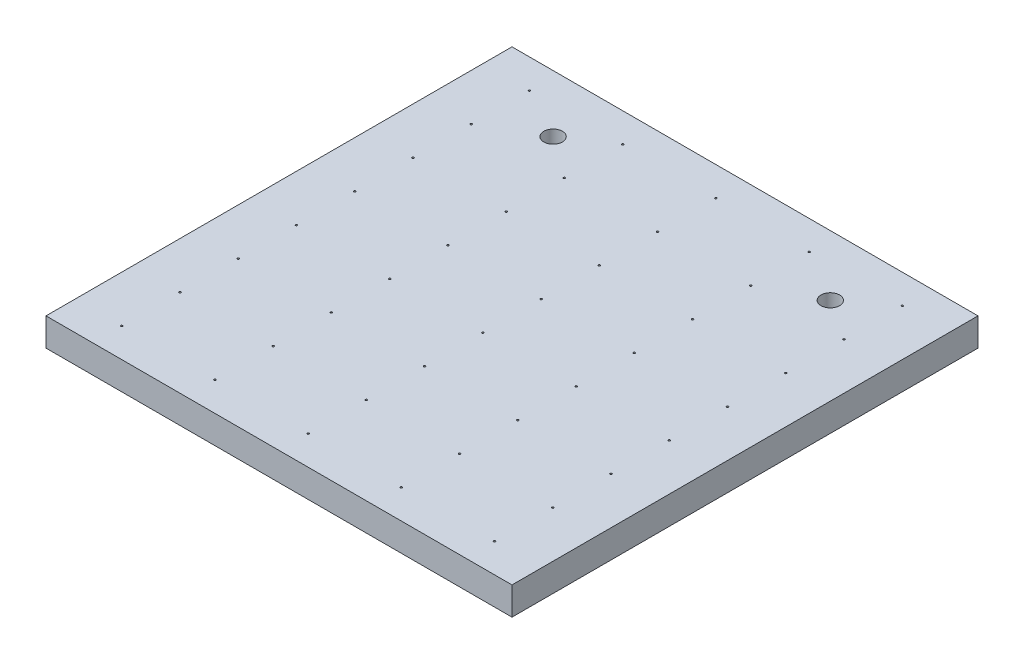
from build123d import *

# Parameters (mm, degrees)
SKETCH_1_W              = 50
SKETCH_1_H              = 50
EXTRUDE_1_DEPTH         = 3
SKETCH_2_R              = 0.1
CUT_EXTRUDE_5_DEPTH     = 0.6
PATTERN_LINEAR_6_COUNT  = 5
PATTERN_LINEAR_6_PITCH  = 10
SKETCH_6_R              = 0.1
CUT_EXTRUDE_6_DEPTH     = 0.8
PATTERN_LINEAR_7_COUNT  = 5
PATTERN_LINEAR_7_PITCH  = 10
SKETCH_7_R              = 0.1
CUT_EXTRUDE_7_DEPTH     = 1
PATTERN_LINEAR_8_COUNT  = 5
PATTERN_LINEAR_8_PITCH  = 10
SKETCH_8_R              = 0.1
CUT_EXTRUDE_8_DEPTH     = 1.2
PATTERN_LINEAR_9_COUNT  = 5
PATTERN_LINEAR_9_PITCH  = 10
SKETCH_9_R              = 0.1
CUT_EXTRUDE_9_DEPTH     = 1.4
PATTERN_LINEAR_10_COUNT = 5
PATTERN_LINEAR_10_PITCH = 10
SKETCH_10_R             = 0.1
CUT_EXTRUDE_10_DEPTH    = 1.6
PATTERN_LINEAR_11_COUNT = 5
PATTERN_LINEAR_11_PITCH = 10
SKETCH_11_R             = 0.1
CUT_EXTRUDE_11_DEPTH    = 1.8
PATTERN_LINEAR_12_COUNT = 5
PATTERN_LINEAR_12_PITCH = 10
SKETCH_12_R             = 0.1
CUT_EXTRUDE_12_DEPTH    = 2
PATTERN_LINEAR_13_COUNT = 5
PATTERN_LINEAR_13_PITCH = 10
SKETCH_13_R             = 1
CUT_EXTRUDE_13_DEPTH    = 36.482389998
SKETCH_14_R             = 1
CUT_EXTRUDE_14_DEPTH    = 36.482389998


with BuildPart() as part:
    # 草图1 → 凸台-拉伸1 (new body)
    with BuildSketch(Plane(origin=(0, 0, 0), x_dir=(1, 0, 0), z_dir=(0, 1, 0))):
        Rectangle(SKETCH_1_W, SKETCH_1_H)
    extrude(amount=EXTRUDE_1_DEPTH)

    # 草图2 → 切除-拉伸5 (cut)
    with BuildSketch(Plane(origin=(0, 3, 0), x_dir=(1, 0, 0), z_dir=(0, 1, 0))):
        with Locations(Location((-20, 21.875, 0), (0, 0, 270))):
            Circle(SKETCH_2_R)
    cut_extrude_5 = extrude(amount=-CUT_EXTRUDE_5_DEPTH, mode=Mode.SUBTRACT)

    # 阵列(线性)6: 切除-拉伸5 ×5
    with Locations(*[(i * PATTERN_LINEAR_6_PITCH, 0, 0) for i in range(1, PATTERN_LINEAR_6_COUNT)]):
        add(cut_extrude_5, mode=Mode.SUBTRACT)

    # 草图6 → 切除-拉伸6 (cut)
    with BuildSketch(Plane(origin=(0, 3, 0), x_dir=(1, 0, 0), z_dir=(0, 1, 0))):
        with Locations(Location((-20, 15.625, 0), (0, 0, 270))):
            Circle(SKETCH_6_R)
    cut_extrude_6 = extrude(amount=-CUT_EXTRUDE_6_DEPTH, mode=Mode.SUBTRACT)

    # 阵列(线性)7: 切除-拉伸6 ×5
    with Locations(*[(i * PATTERN_LINEAR_7_PITCH, 0, 0) for i in range(1, PATTERN_LINEAR_7_COUNT)]):
        add(cut_extrude_6, mode=Mode.SUBTRACT)

    # 草图7 → 切除-拉伸7 (cut)
    with BuildSketch(Plane(origin=(0, 3, 0), x_dir=(1, 0, 0), z_dir=(0, 1, 0))):
        with Locations(Location((-20, 9.375, 0), (0, 0, 270))):
            Circle(SKETCH_7_R)
    cut_extrude_7 = extrude(amount=-CUT_EXTRUDE_7_DEPTH, mode=Mode.SUBTRACT)

    # 阵列(线性)8: 切除-拉伸7 ×5
    with Locations(*[(i * PATTERN_LINEAR_8_PITCH, 0, 0) for i in range(1, PATTERN_LINEAR_8_COUNT)]):
        add(cut_extrude_7, mode=Mode.SUBTRACT)

    # 草图8 → 切除-拉伸8 (cut)
    with BuildSketch(Plane(origin=(0, 3, 0), x_dir=(1, 0, 0), z_dir=(0, 1, 0))):
        with Locations(Location((-20, 3.125, 0), (0, 0, 270))):
            Circle(SKETCH_8_R)
    cut_extrude_8 = extrude(amount=-CUT_EXTRUDE_8_DEPTH, mode=Mode.SUBTRACT)

    # 阵列(线性)9: 切除-拉伸8 ×5
    with Locations(*[(i * PATTERN_LINEAR_9_PITCH, 0, 0) for i in range(1, PATTERN_LINEAR_9_COUNT)]):
        add(cut_extrude_8, mode=Mode.SUBTRACT)

    # 草图9 → 切除-拉伸9 (cut)
    with BuildSketch(Plane(origin=(0, 3, 0), x_dir=(1, 0, 0), z_dir=(0, 1, 0))):
        with Locations(Location((-20, -3.125, 0), (0, 0, 270))):
            Circle(SKETCH_9_R)
    cut_extrude_9 = extrude(amount=-CUT_EXTRUDE_9_DEPTH, mode=Mode.SUBTRACT)

    # 阵列(线性)10: 切除-拉伸9 ×5
    with Locations(*[(i * PATTERN_LINEAR_10_PITCH, 0, 0) for i in range(1, PATTERN_LINEAR_10_COUNT)]):
        add(cut_extrude_9, mode=Mode.SUBTRACT)

    # 草图10 → 切除-拉伸10 (cut)
    with BuildSketch(Plane(origin=(0, 3, 0), x_dir=(1, 0, 0), z_dir=(0, 1, 0))):
        with Locations(Location((-20, -9.375, 0), (0, 0, 270))):
            Circle(SKETCH_10_R)
    cut_extrude_10 = extrude(amount=-CUT_EXTRUDE_10_DEPTH, mode=Mode.SUBTRACT)

    # 阵列(线性)11: 切除-拉伸10 ×5
    with Locations(*[(i * PATTERN_LINEAR_11_PITCH, 0, 0) for i in range(1, PATTERN_LINEAR_11_COUNT)]):
        add(cut_extrude_10, mode=Mode.SUBTRACT)

    # 草图11 → 切除-拉伸11 (cut)
    with BuildSketch(Plane(origin=(0, 3, 0), x_dir=(1, 0, 0), z_dir=(0, 1, 0))):
        with Locations(Location((-20, -15.625, 0), (0, 0, 270))):
            Circle(SKETCH_11_R)
    cut_extrude_11 = extrude(amount=-CUT_EXTRUDE_11_DEPTH, mode=Mode.SUBTRACT)

    # 阵列(线性)12: 切除-拉伸11 ×5
    with Locations(*[(i * PATTERN_LINEAR_12_PITCH, 0, 0) for i in range(1, PATTERN_LINEAR_12_COUNT)]):
        add(cut_extrude_11, mode=Mode.SUBTRACT)

    # 草图12 → 切除-拉伸12 (cut)
    with BuildSketch(Plane(origin=(0, 3, 0), x_dir=(1, 0, 0), z_dir=(0, 1, 0))):
        with Locations(Location((-20, -21.875, 0), (0, 0, 270))):
            Circle(SKETCH_12_R)
    cut_extrude_12 = extrude(amount=-CUT_EXTRUDE_12_DEPTH, mode=Mode.SUBTRACT)

    # 阵列(线性)13: 切除-拉伸12 ×5
    with Locations(*[(i * PATTERN_LINEAR_13_PITCH, 0, 0) for i in range(1, PATTERN_LINEAR_13_COUNT)]):
        add(cut_extrude_12, mode=Mode.SUBTRACT)

    # 草图13 → 切除-拉伸13 (cut, through all)
    with BuildSketch(Plane(origin=(0, 3, 0), x_dir=(1, 0, 0), z_dir=(0, 1, 0))):
        with Locations(Location((-14.45079135, 18.860165377, 0), (0, 0, 270))):
            Circle(SKETCH_13_R)
    extrude(amount=-CUT_EXTRUDE_13_DEPTH, mode=Mode.SUBTRACT)

    # 草图14 → 切除-拉伸14 (cut, through all)
    with BuildSketch(Plane(origin=(0, 3, 0), x_dir=(1, 0, 0), z_dir=(0, 1, 0))):
        with Locations(Location((15.632161643, 18.520713251, 0), (0, 0, 270))):
            Circle(SKETCH_14_R)
    extrude(amount=-CUT_EXTRUDE_14_DEPTH, mode=Mode.SUBTRACT)


solid = part.part
